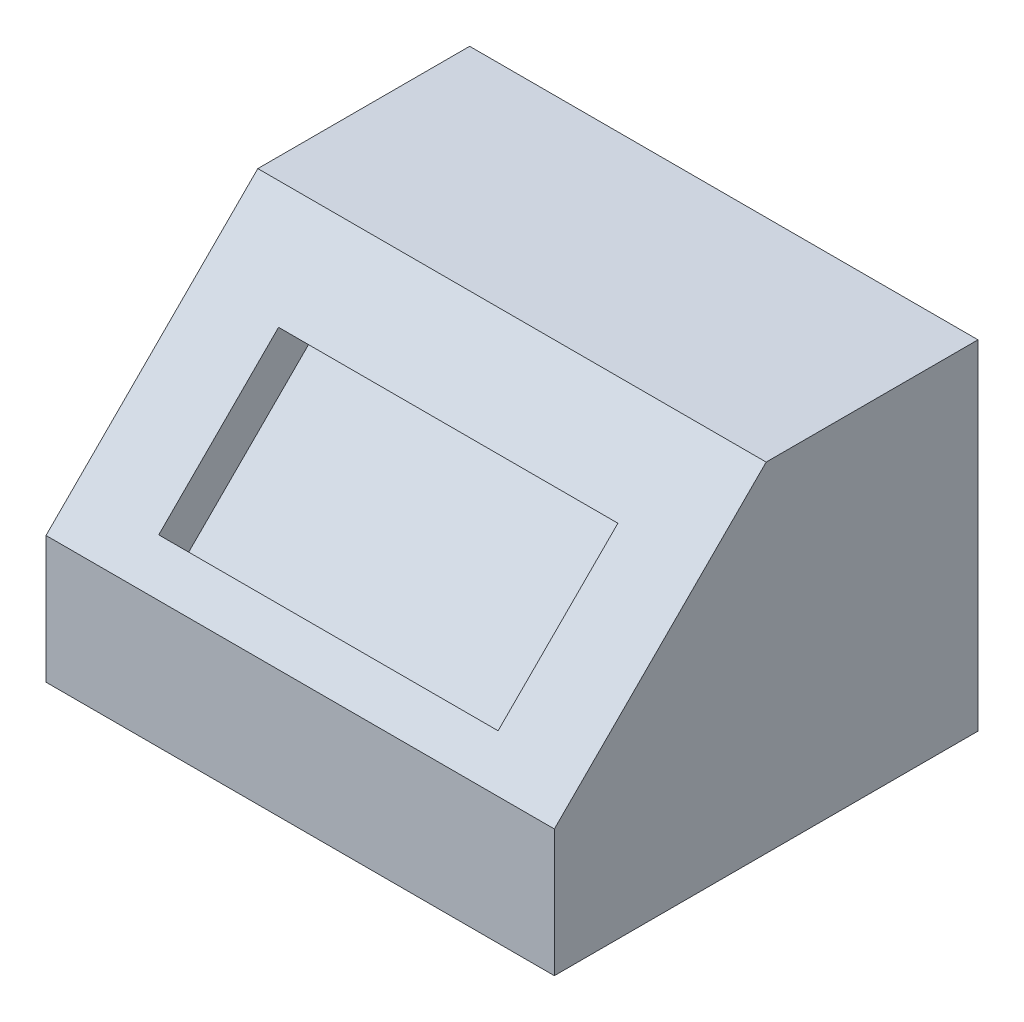
from build123d import *

# Parameters (mm, degrees)
SKETCH1_W           = 152.4
SKETCH1_H           = 101.6
BOSS_EXTRUDE1_DEPTH = 127
CUT_EXTRUDE1_DEPTH  = 134.62
CUT_EXTRUDE2_DEPTH  = 134.62
SKETCH5_W           = 101.732493014
SKETCH5_H           = 12.7
CUT_EXTRUDE4_DEPTH  = 50.8


with BuildPart() as part:
    # Sketch1 → Boss-Extrude1 (new body)
    with BuildSketch(Plane.XY):
        with Locations((-47.482496627, -19.988512007)):
            Rectangle(SKETCH1_W, SKETCH1_H)
    extrude(amount=-BOSS_EXTRUDE1_DEPTH)

    # Sketch2 → Cut-Extrude1 (cut)
    with BuildSketch(Plane(origin=(0, 0, 0), x_dir=(0, 0, -1), z_dir=(1, 0, 0))):
        Polygon((0, 30.811487993), (0, -32.688512007), (63.5, 30.811487993), align=None)
    extrude(amount=CUT_EXTRUDE1_DEPTH, mode=Mode.SUBTRACT)

    # Sketch3 → Cut-Extrude2 (cut)
    with BuildSketch(Plane(origin=(0, 0, 0), x_dir=(0, 0, -1), z_dir=(1, 0, 0))):
        Polygon((0, -32.688512007), (0, 30.811487993), (63.5, 30.811487993), align=None)
    extrude(amount=-CUT_EXTRUDE2_DEPTH, mode=Mode.SUBTRACT)

    # Sketch5 → Cut-Extrude4 (cut)
    with BuildSketch(Plane(origin=(0, 28.105743997, -28.105743997), x_dir=(1, 0, 0), z_dir=(0, -0.7071067811865512, 0.7071067811865438))):
        with Locations((-47.548743134, -29.464268507)):
            Rectangle(SKETCH5_W, SKETCH5_H)
    extrude(amount=CUT_EXTRUDE4_DEPTH, mode=Mode.SUBTRACT)


solid = part.part
